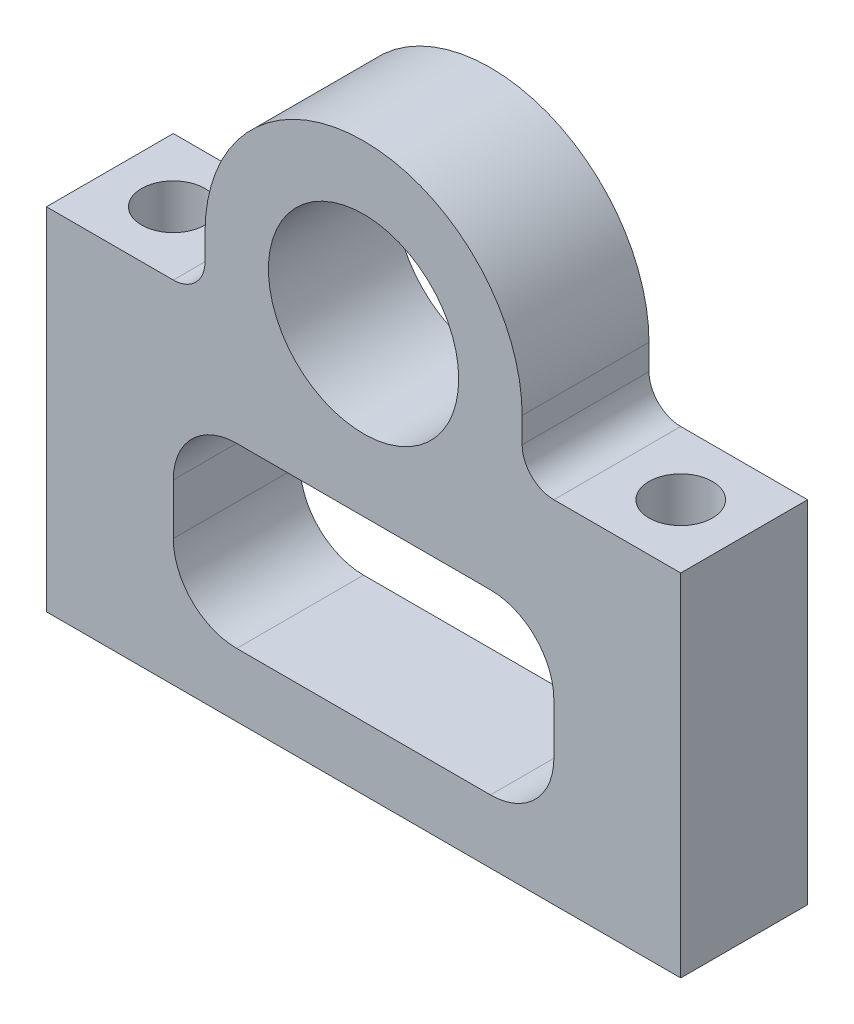
from build123d import *
from build123d.topology import SkipClean

# Parameters (mm, degrees)
SKETCH1_R           = 7.5
BOSS_EXTRUDE1_DEPTH = 10
SKETCH4_R           = 2.5
CUT_EXTRUDE1_DEPTH  = 20
SKETCH5_W           = 50
SKETCH5_H           = 10
SKETCH5_R           = 2.5
BOSS_EXTRUDE2_DEPTH = 17.65
CUT_EXTRUDE3_DEPTH  = 17.65


with BuildPart() as part:
    # Sketch1 → Boss-Extrude1 (new body)
    with BuildSketch(Plane.XY):
        with BuildLine():
            Line((0, 0), (-25, 0))
            Line((-25, 0), (-25, 10))
            Line((-25, 10), (-15, 10))
            ThreePointArc((-15, 10), (-13.232233047, 10.732233047), (-12.5, 12.5))
            Line((-12.5, 12.5), (-12.5, 14.5))
            ThreePointArc((-12.5, 14.5), (0, 27), (12.5, 14.5))
            Line((12.5, 14.5), (12.5, 12.5))
            ThreePointArc((12.5, 12.5), (13.232233047, 10.732233047), (15, 10))
            Line((15, 10), (25, 10))
            Line((25, 10), (25, 0))
            Line((25, 0), (0, 0))
        make_face()
        with Locations((0, 14.5)):
            Circle(SKETCH1_R, mode=Mode.SUBTRACT)
    extrude(amount=BOSS_EXTRUDE1_DEPTH)

    # Sketch4 → Cut-Extrude1 (cut)
    with BuildSketch(Plane(origin=(0, 10, 0), x_dir=(1, 0, 0), z_dir=(0, 1, 0))):
        with Locations(Location((-20, -5, 0), (0, 0, 270))):
            Circle(SKETCH4_R)
        with Locations(Location((20, -5, 0), (0, 0, 180))):
            Circle(SKETCH4_R)
    extrude(amount=-CUT_EXTRUDE1_DEPTH, mode=Mode.SUBTRACT)

    # Sketch5 → Boss-Extrude2 (add)
    with SkipClean():  # the faces are left unmerged after this step: merging them gives an invalid solid
        with BuildSketch(Plane.XZ):
            with Locations((0, 5)):
                Rectangle(SKETCH5_W, SKETCH5_H)
            with Locations(Location((-20, 5, 0), (0, 0, 90))):
                Circle(SKETCH5_R, mode=Mode.SUBTRACT)
            with Locations((20, 5)):
                Circle(SKETCH5_R, mode=Mode.SUBTRACT)
        extrude(amount=BOSS_EXTRUDE2_DEPTH)

    # Sketch6 → Cut-Extrude3 (cut)
    with SkipClean():  # the faces are left unmerged after this step: merging them gives an invalid solid
        with BuildSketch(Plane.XY.offset(10)):
            with BuildLine():
                Line((10, 1.35), (-10, 1.35))
                ThreePointArc((-10, 1.35), (-13.535533906, -0.114466094), (-15, -3.65))
                Line((-15, -3.65), (-15, -7.65))
                ThreePointArc((-15, -7.65), (-13.535533906, -11.185533906), (-10, -12.65))
                Line((-10, -12.65), (10, -12.65))
                ThreePointArc((10, -12.65), (13.535533906, -11.185533906), (15, -7.65))
                Line((15, -7.65), (15, -3.65))
                ThreePointArc((15, -3.65), (13.535533906, -0.114466094), (10, 1.35))
            make_face()
        extrude(amount=-CUT_EXTRUDE3_DEPTH, mode=Mode.SUBTRACT)


solid = part.part
